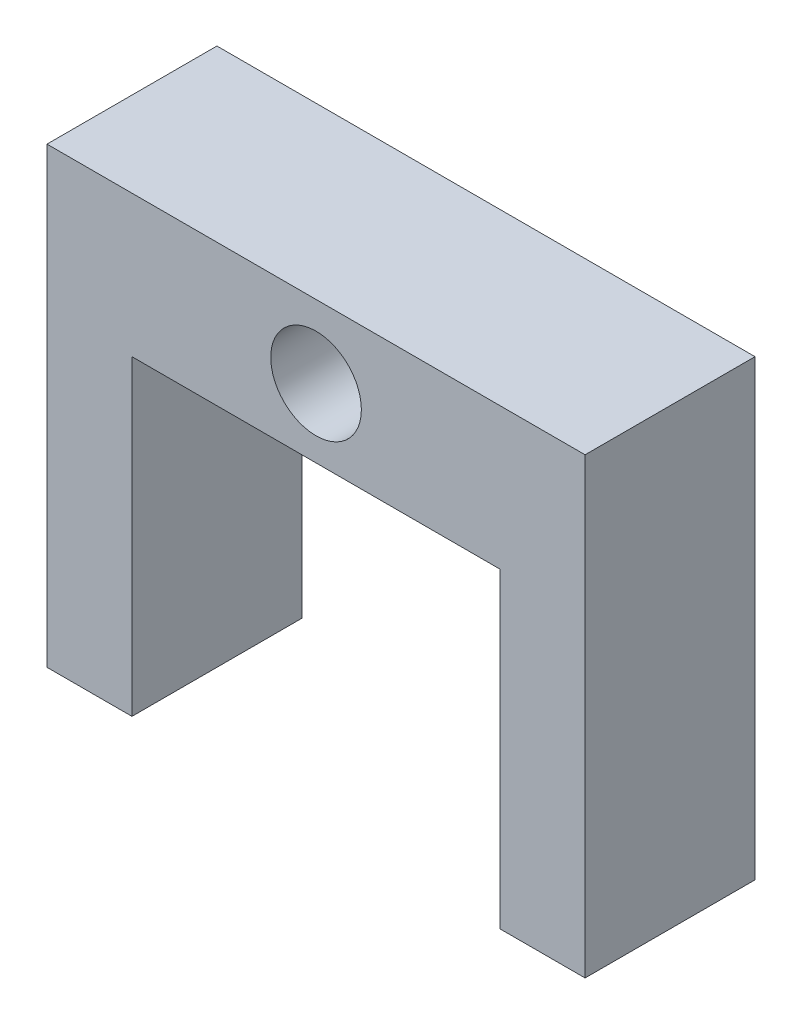
from build123d import *

# Parameters (mm, degrees)
SKETCH_1_R      = 1.6
EXTRUDE_1_DEPTH = 6


with BuildPart() as part:
    # 草图1 → 凸台-拉伸1 (new body)
    with BuildSketch(Plane.XY):
        Polygon((0, 0), (3, 0), (3, 11), (16, 11), (16, 0), (19, 0), (19, 16), (0, 16), align=None)
        with Locations((9.5, 13.430729966)):
            Circle(SKETCH_1_R, mode=Mode.SUBTRACT)
    extrude(amount=EXTRUDE_1_DEPTH)


solid = part.part
